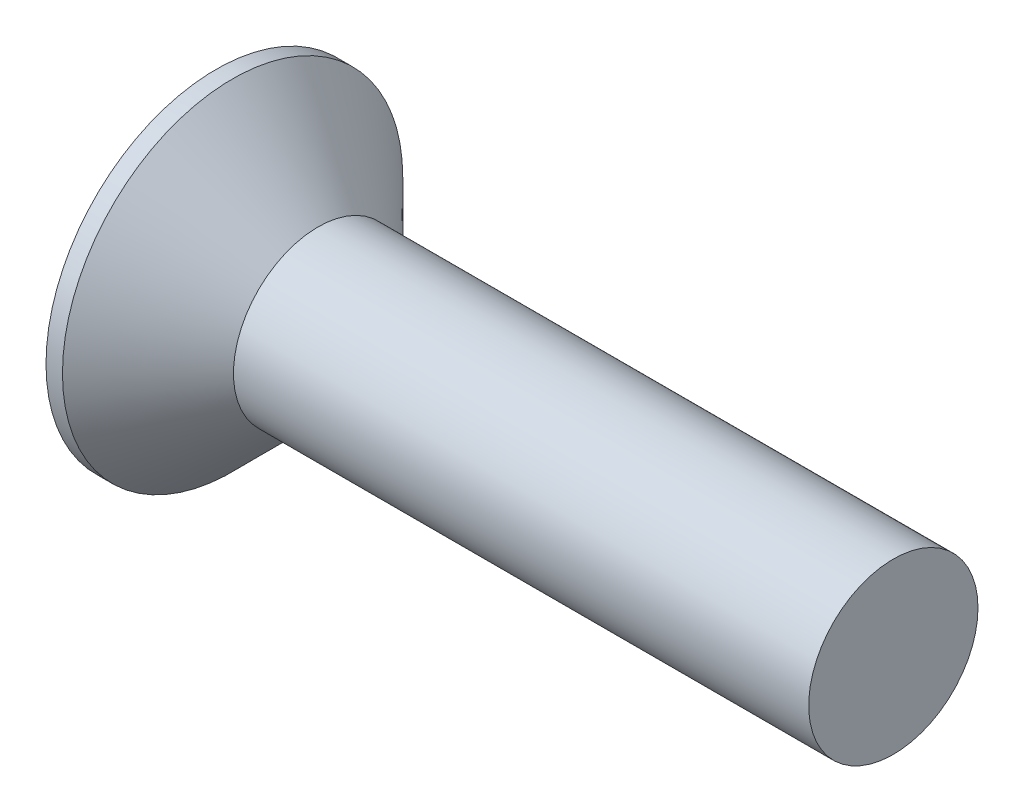
from build123d import *

# Parameters (mm, degrees)
BASETOP_FACE_RADIUS = 4.02
BASETOP_HEIGHT      = 1
CROSSRECESS_DEPTH   = 1.35
DRAFT9_ANGLE        = -30
FILLET5_R           = 0.3


with BuildPart() as part:
    # Sketch1 → Base (revolve)
    with BuildSketch(Plane.XY, mode=Mode.PRIVATE) as base_sk:
        Polygon((16, 2), (4.187867966, 2), (2.408867966, 2), (0.388867966, 4.02), (0, 4.02), (0, 0), (16, 0), align=None)
    revolve(base_sk.sketch.rotate(Axis((4.515812911, 0, 0), (-1, 0, 0)), 90), axis=Axis((4.515812911, 0, 0), (-1, 0, 0)))

    # BaseTop: a dome of height H over a round flat face of radius A is a cap of a sphere of radius (A * A + H * H) / (2 * H)
    basetop_r = (BASETOP_FACE_RADIUS * BASETOP_FACE_RADIUS + BASETOP_HEIGHT * BASETOP_HEIGHT) / (2 * BASETOP_HEIGHT)
    basetop_base = Plane((0, 0, 0), z_dir=(-1, 0, 0))
    with Locations(basetop_base.offset(BASETOP_HEIGHT - basetop_r)):
        basetop_ball = Sphere(basetop_r, mode=Mode.PRIVATE)
    add(split(basetop_ball, bisect_by=basetop_base, keep=Keep.TOP, mode=Mode.PRIVATE))

    # Sketch6 → CrossRecess (cut)
    with BuildSketch(Plane.ZY.offset(1)):
        Polygon((0.52, 0.52), (0.52, 2.6), (-0.52, 2.6), (-0.52, 0.52), (-2.6, 0.52), (-2.6, -0.52), (-0.52, -0.52), (-0.52, -2.6), (0.52, -2.6), (0.52, -0.52), (2.6, -0.52), (2.6, 0.52), align=None)
    extrude(amount=-CROSSRECESS_DEPTH, mode=Mode.SUBTRACT)

    # Draft9
    draft9_faces = [part.faces().sort_by_distance(p)[0] for p in [
        (-0.120548575, 0, -2.6),
        (-0.120548575, -2.6, 0),
        (-0.120548575, 0, 2.6),
        (-0.120548575, 2.6, 0),
    ]]
    draft(draft9_faces, Plane(origin=(-1, 0, 0), x_dir=(0, 0, 1), z_dir=(1, 0, 0)), DRAFT9_ANGLE)

    # Fillet5
    fillet5_edges = [part.edges().sort_by_distance(p)[0] for p in [
        (-0.309213747, 0.52, -0.52),
        (-0.309213747, 0.52, 0.52),
        (-0.309213747, -0.52, 0.52),
        (-0.309213747, -0.52, -0.52),
    ]]
    fillet(fillet5_edges, radius=FILLET5_R)


solid = part.part
